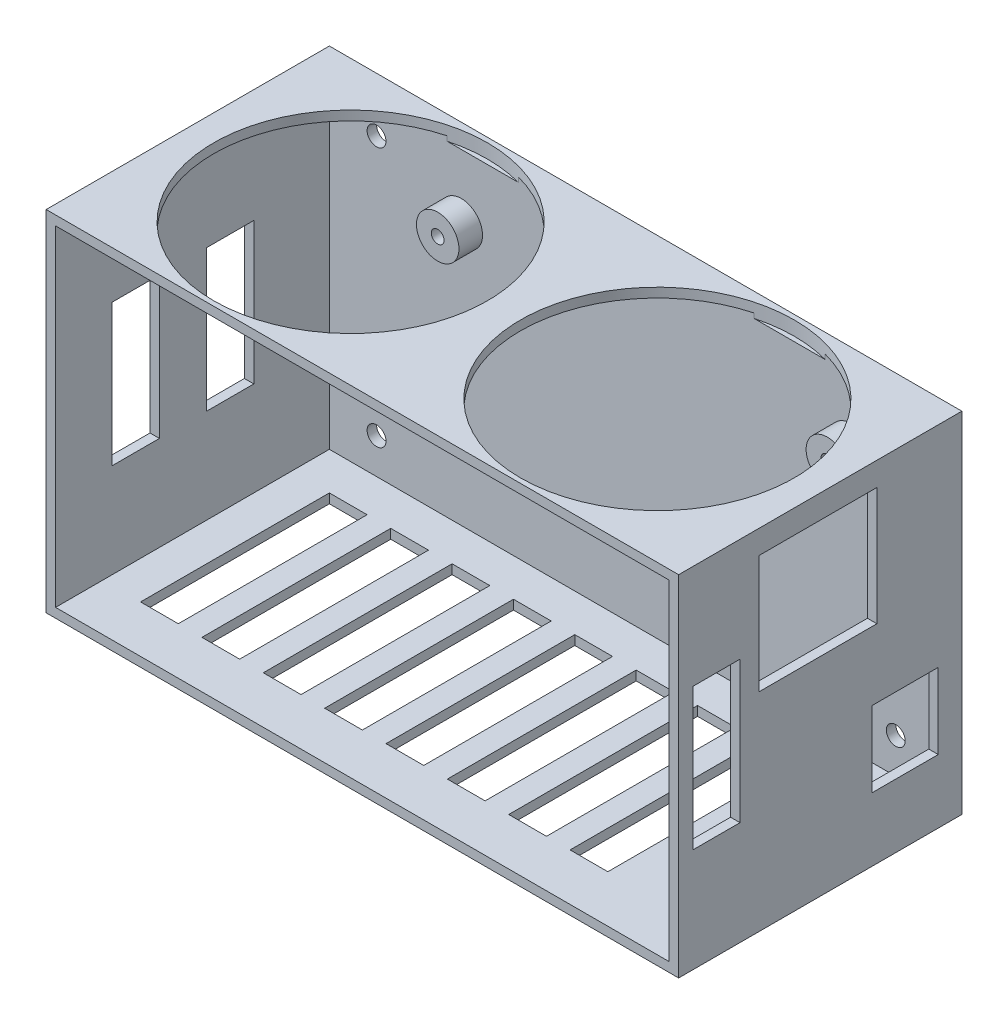
from build123d import *
from build123d.topology import SkipClean

# Parameters (mm, degrees)
ESBO_O1_W                = 134
ESBO_O1_H                = 74
ESBO_O1_W_2              = 130
ESBO_O1_H_2              = 70
RESSALTO_EXTRUS_O1_DEPTH = 60
ESBO_O2_W                = 134
ESBO_O2_H                = 74
ESBO_O2_R                = 2
RESSALTO_EXTRUS_O2_DEPTH = 2
ESBO_O3_W                = 25
ESBO_O3_H                = 25
ESBO_O3_W_2              = 14
ESBO_O3_H_2              = 16
ESBO_O3_W_3              = 10
ESBO_O3_H_3              = 30
CORTE_EXTRUS_O1_DEPTH    = 10
ESBO_O6_W                = 8
ESBO_O6_H                = 40
CORTE_EXTRUS_O2_DEPTH    = 10
ESBO_O7_W                = 10
ESBO_O7_H                = 30
CORTE_EXTRUS_O3_DEPTH    = 12
ESBO_O8_R                = 4.5
ESBO_O8_R_2              = 1.35
RESSALTO_EXTRUS_O3_DEPTH = 5
ESBO_O8_3_R              = 1.35
CORTE_EXTRUS_O4_DEPTH    = 97.031244915
ESBO_O9_R                = 3
CORTE_EXTRUS_O5_DEPTH    = 2
ESBO_O10_R               = 29
CORTE_EXTRUS_O6_DEPTH    = 3


with BuildPart() as part:
    # Esboço1 → Ressalto-extrusão1 (new body)
    with BuildSketch(Plane.XY):
        Rectangle(ESBO_O1_W, ESBO_O1_H)
        Rectangle(ESBO_O1_W_2, ESBO_O1_H_2, mode=Mode.SUBTRACT)
    extrude(amount=RESSALTO_EXTRUS_O1_DEPTH)

    # Esboço2 → Ressalto-extrusão2 (add)
    with BuildSketch(Plane(origin=(0, 0, 0), x_dir=(-1, 0, 0), z_dir=(0, 0, -1))):
        Rectangle(ESBO_O2_W, ESBO_O2_H)
        with Locations((-55, -27.5)):
            Circle(ESBO_O2_R, mode=Mode.SUBTRACT)
        with Locations((55, -27.5)):
            Circle(ESBO_O2_R, mode=Mode.SUBTRACT)
        with Locations((55, 27.5)):
            Circle(ESBO_O2_R, mode=Mode.SUBTRACT)
        with Locations((-55, 27.5)):
            Circle(ESBO_O2_R, mode=Mode.SUBTRACT)
    extrude(amount=-RESSALTO_EXTRUS_O2_DEPTH)

    # Esboço3 → Corte-extrusão1 (cut)
    with BuildSketch(Plane(origin=(67, 0, 0), x_dir=(0, 0, -1), z_dir=(1, 0, 0))):
        with Locations((-30.5, 19.5)):
            Rectangle(ESBO_O3_W, ESBO_O3_H)
        with Locations((-12, -15.5)):
            Rectangle(ESBO_O3_W_2, ESBO_O3_H_2)
        with Locations((-52, 0)):
            Rectangle(ESBO_O3_W_3, ESBO_O3_H_3)
    extrude(amount=-CORTE_EXTRUS_O1_DEPTH, mode=Mode.SUBTRACT)

    # Esboço6 → Corte-extrusão2 (cut)
    with BuildSketch(Plane.XZ.offset(37)):
        with Locations((-53, 30)):
            Rectangle(ESBO_O6_W, ESBO_O6_H)
        with Locations((-40, 30)):
            Rectangle(ESBO_O6_W, ESBO_O6_H)
        with Locations((-27, 30)):
            Rectangle(ESBO_O6_W, ESBO_O6_H)
        with Locations((-14, 30)):
            Rectangle(ESBO_O6_W, ESBO_O6_H)
        with Locations((-1, 30)):
            Rectangle(ESBO_O6_W, ESBO_O6_H)
        with Locations((12, 30)):
            Rectangle(ESBO_O6_W, ESBO_O6_H)
        with Locations((25, 30)):
            Rectangle(ESBO_O6_W, ESBO_O6_H)
        with Locations((38, 30)):
            Rectangle(ESBO_O6_W, ESBO_O6_H)
    extrude(amount=-CORTE_EXTRUS_O2_DEPTH, mode=Mode.SUBTRACT)

    # Esboço7 → Corte-extrusão3 (cut)
    with BuildSketch(Plane.ZY.offset(67)):
        with Locations((43, 0)):
            Rectangle(ESBO_O7_W, ESBO_O7_H)
        with Locations((23, 0)):
            Rectangle(ESBO_O7_W, ESBO_O7_H)
    extrude(amount=-CORTE_EXTRUS_O3_DEPTH, mode=Mode.SUBTRACT)

    # Esboço8 → Ressalto-extrusão3 (add)
    # profile 1 of 3: a face of its own
    with BuildSketch(Plane(origin=(0, 0, 2), x_dir=(-1, 0, 0), z_dir=(0, 0, -1))):
        with Locations(Location((37.05, 20.5, 0), (0, 0, 180))):
            Circle(ESBO_O8_R)
        with Locations(Location((37.05, 20.5, 0), (0, 0, 180))):
            Circle(ESBO_O8_R_2, mode=Mode.SUBTRACT)
    # profile 2 of 3: a face of its own
    with BuildSketch(Plane(origin=(0, 0, 2), x_dir=(-1, 0, 0), z_dir=(0, 0, -1))):
        with Locations(Location((-45.5, 20.5, 0), (0, 0, 180))):
            Circle(ESBO_O8_R)
        with Locations(Location((-45.5, 20.5, 0), (0, 0, 180))):
            Circle(ESBO_O8_R_2, mode=Mode.SUBTRACT)
    # profile 3 of 3: a face of its own
    with BuildSketch(Plane(origin=(0, 0, 2), x_dir=(-1, 0, 0), z_dir=(0, 0, -1))):
        with Locations(Location((-44.2, -26.5, 0), (0, 0, 180))):
            Circle(ESBO_O8_R)
        with Locations(Location((-44.2, -26.5, 0), (0, 0, 180))):
            Circle(ESBO_O8_R_2, mode=Mode.SUBTRACT)
    extrude(amount=-RESSALTO_EXTRUS_O3_DEPTH)

    # Esboço8<3> → Corte-extrusão4 (cut, through all)
    with SkipClean():  # the faces are left unmerged after this step: merging them gives an invalid solid
        with BuildSketch(Plane(origin=(0, 0, 2), x_dir=(-1, 0, 0), z_dir=(0, 0, -1))):
            with Locations((-44.2, -26.5)):
                Circle(ESBO_O8_3_R)
            with Locations((37.05, 20.5)):
                Circle(ESBO_O8_3_R)
            with Locations((-45.5, 20.5)):
                Circle(ESBO_O8_3_R)
        extrude(amount=CORTE_EXTRUS_O4_DEPTH, mode=Mode.SUBTRACT)

    # Esboço9 → Corte-extrusão5 (cut)
    with BuildSketch(Plane.XY.offset(2)):
        with Locations((45.5, 20.5)):
            Circle(ESBO_O9_R)
        with Locations((44.2, -26.5)):
            Circle(ESBO_O9_R)
        with Locations((-37.05, 20.5)):
            Circle(ESBO_O9_R)
    extrude(amount=CORTE_EXTRUS_O5_DEPTH, mode=Mode.SUBTRACT)

    # Esboço10 → Corte-extrusão6 (cut)
    with BuildSketch(Plane(origin=(0, 37, 0), x_dir=(1, 0, 0), z_dir=(0, 1, 0))):
        with Locations(Location((32.5, -30, 0), (0, 0, 270))):
            Circle(ESBO_O10_R)
        with Locations(Location((-32.5, -30, 0), (0, 0, 270))):
            Circle(ESBO_O10_R)
    extrude(amount=-CORTE_EXTRUS_O6_DEPTH, mode=Mode.SUBTRACT)


solid = part.part
